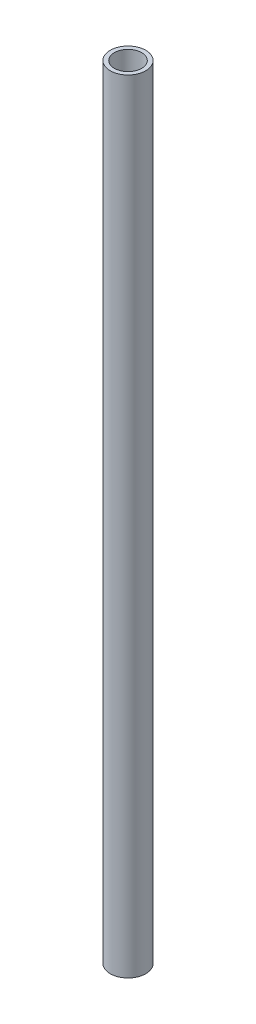
from build123d import *

# Parameters (mm, degrees)
SKETCH1_R           = 6.35
SKETCH1_R_2         = 4.8768
BOSS_EXTRUDE1_DEPTH = 279.52319


with BuildPart() as part:
    # Sketch1 → Boss-Extrude1 (new body)
    with BuildSketch(Plane(origin=(0, 0, 0), x_dir=(1, 0, 0), z_dir=(0, 1, 0))):
        with Locations(Location((0, 0, 0), (0, 0, 167.83623105))):
            Circle(SKETCH1_R)
        with Locations(Location((0, 0, 0), (0, 0, 167.83623105))):
            Circle(SKETCH1_R_2, mode=Mode.SUBTRACT)
    extrude(amount=BOSS_EXTRUDE1_DEPTH)


solid = part.part
